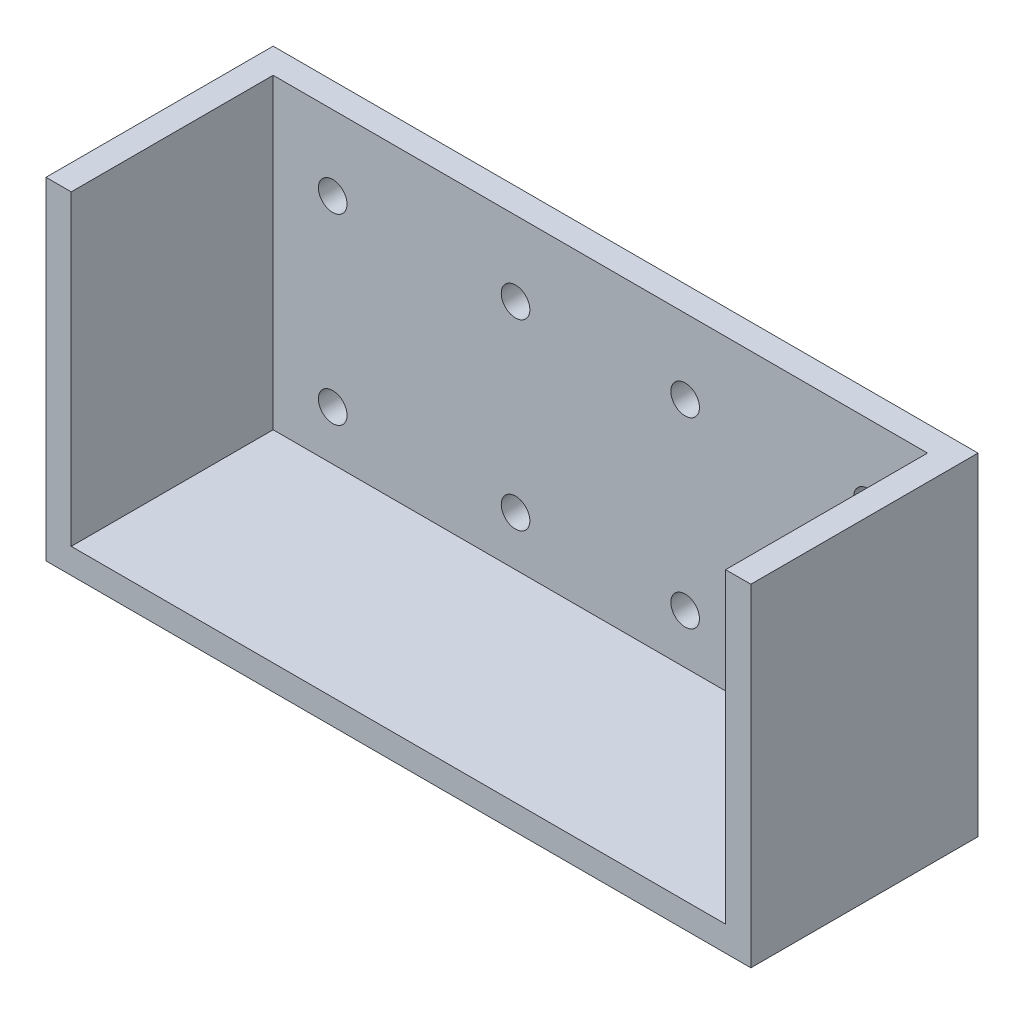
from build123d import *

# Parameters (mm, degrees)
SKETCH2_W                = 82.31886
SKETCH2_H                = 38.6207
BOSS_EXTRUDE1_DEPTH      = 3.175
BOSS_EXTRUDE2_DEPTH      = 25.4
BOSS_EXTRUDE2_DEPTH_BACK = 3.175
SKETCH3_W                = 3.175
SKETCH3_H                = 38.6207
SKETCH4_R                = 0.561869351
SKETCH4_R_2              = 0.521667109
SKETCH4_R_3              = 0.606918095
SKETCH4_R_4              = 0.92346357
CUT_EXTRUDE1_DEPTH       = 94.276837661
M3_CLEARANCE_HOLE1_D     = 3.6


with BuildPart() as part:
    # Sketch2 → Boss-Extrude1 (new body)
    with BuildSketch(Plane.XY):
        with Locations((37.34943, 15.50035)):
            Rectangle(SKETCH2_W, SKETCH2_H)
    extrude(amount=BOSS_EXTRUDE1_DEPTH)

    # Sketch3 → Boss-Extrude2 (add, two sides: drawn at the far end of the back side and taken through both)
    with BuildSketch(Plane.XY.offset(3.175).offset(-BOSS_EXTRUDE2_DEPTH_BACK)):
        with Locations((-5.3975, 15.50035)):
            Rectangle(SKETCH3_W, SKETCH3_H)
        with Locations((80.09636, 15.50035)):
            Rectangle(SKETCH3_W, SKETCH3_H)
        Polygon((78.50886, -3.81), (-3.81, -3.81), (-6.985, -3.81), (-6.985, -6.985), (81.68386, -6.985), (81.68386, -3.81), align=None)
    extrude(amount=BOSS_EXTRUDE2_DEPTH + BOSS_EXTRUDE2_DEPTH_BACK)

    # Sketch4 → Cut-Extrude1 (cut, through all)
    with BuildSketch(Plane(origin=(0, 0, 0), x_dir=(-1, 0, 0), z_dir=(0, 0, -1))):
        with Locations((-26.682215, 25.41285)):
            Circle(SKETCH4_R)
        with Locations((-3.682215, 25.41285)):
            Circle(SKETCH4_R_2)
        with Locations((-26.682215, 2.41285)):
            Circle(SKETCH4_R_3)
        with Locations((-3.682215, 2.41285)):
            Circle(SKETCH4_R_4)
        with Locations((-48.016645, 2.41285)):
            Circle(SKETCH4_R_3)
        with Locations((-71.016645, 2.41285)):
            Circle(SKETCH4_R_4)
        with Locations((-71.016645, 25.41285)):
            Circle(SKETCH4_R_2)
        with Locations((-48.016645, 25.41285)):
            Circle(SKETCH4_R)
    extrude(amount=-CUT_EXTRUDE1_DEPTH, mode=Mode.SUBTRACT)

    # M3 Clearance Hole1 (through all)
    with Locations(Plane(origin=(0, 0, 0), x_dir=(-1, 0, 0), z_dir=(0, 0, -1))):
        with Locations((-71.016645, 25.41285), (-71.016645, 2.41285), (-3.682215, 2.41285), (-26.682215, 2.41285), (-48.016645, 2.41285), (-48.016645, 25.41285), (-26.682215, 25.41285), (-3.682215, 25.41285)):
            Hole(M3_CLEARANCE_HOLE1_D / 2)


solid = part.part
